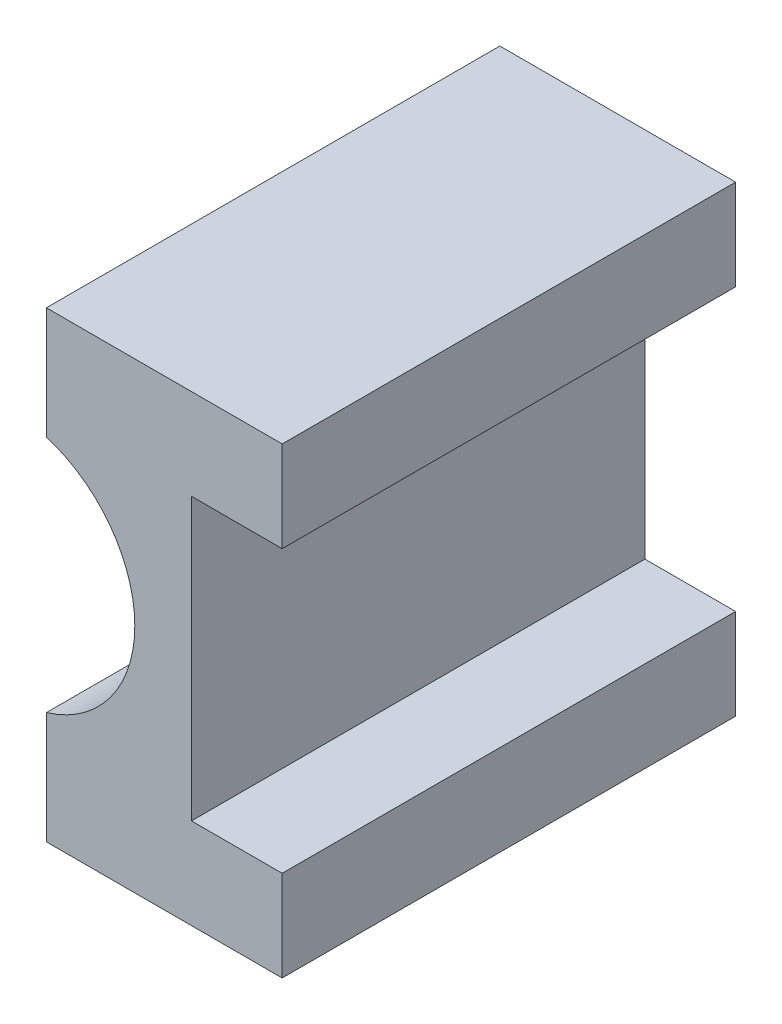
from build123d import *

# Parameters (mm, degrees)
EXTRUDE_1_DEPTH = 10


with BuildPart() as part:
    # ｽｹｯﾁ1 → ﾎﾞｽ - 押し出し1 (new body)
    with BuildSketch(Plane.XY):
        with BuildLine():
            Line((4, -3.1), (4, 3.1))
            Line((4, 3.1), (6, 3.1))
            Line((6, 3.1), (6, 5.1))
            Line((6, 5.1), (0.8, 5.1))
            Line((0.8, 5.1), (0.8, 3))
            Line((0.8, 3), (0.8, 2.631064423))
            ThreePointArc((0.8, 2.631064423), (2.75, 0), (0.8, -2.631064423))
            Line((0.8, -2.631064423), (0.8, -3))
            Line((0.8, -3), (0.8, -5.1))
            Line((0.8, -5.1), (6, -5.1))
            Line((6, -5.1), (6, -3.1))
            Line((6, -3.1), (4, -3.1))
        make_face()
    extrude(amount=EXTRUDE_1_DEPTH)


solid = part.part
